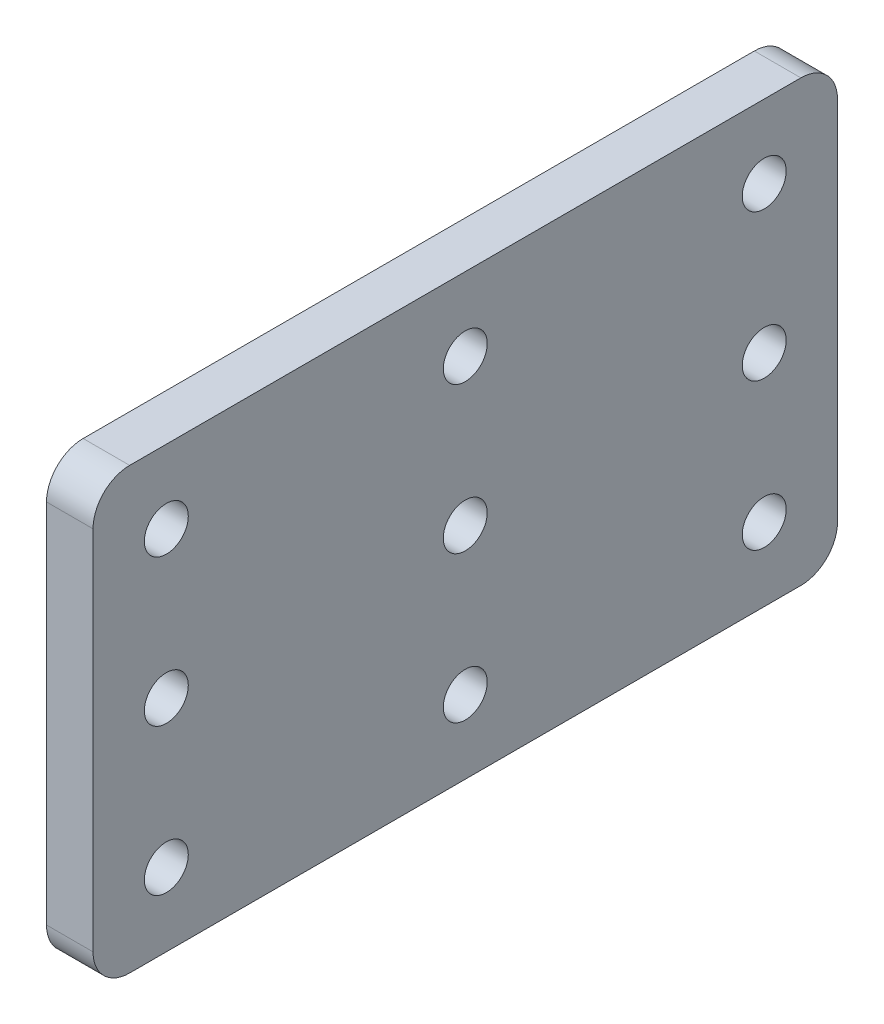
from build123d import *

# Parameters (mm, degrees)
SKETCH1_W           = 6.35
SKETCH1_H           = 60
BOSS_EXTRUDE1_DEPTH = 101.6
SKETCH2_R           = 3
CUT_EXTRUDE1_DEPTH  = 10
FILLET1_R           = 5


with BuildPart() as part:
    # Sketch1 → Boss-Extrude1 (new body)
    with BuildSketch(Plane.XY):
        with Locations((83.183251365, 0)):
            Rectangle(SKETCH1_W, SKETCH1_H)
    extrude(amount=BOSS_EXTRUDE1_DEPTH)

    # Sketch2 → Cut-Extrude1 (cut)
    with BuildSketch(Plane(origin=(86.358251365, 0, 0), x_dir=(0, 0, -1), z_dir=(1, 0, 0))):
        with Locations((-10, -20)):
            Circle(SKETCH2_R)
        with Locations((-10, 20)):
            Circle(SKETCH2_R)
        with Locations((-10, 0)):
            Circle(SKETCH2_R)
        with Locations((-50.8, 20)):
            Circle(SKETCH2_R)
        with Locations((-50.8, 0)):
            Circle(SKETCH2_R)
        with Locations((-50.8, -20)):
            Circle(SKETCH2_R)
        with Locations((-91.6, -20)):
            Circle(SKETCH2_R)
        with Locations((-91.6, 0)):
            Circle(SKETCH2_R)
        with Locations((-91.6, 20)):
            Circle(SKETCH2_R)
    extrude(amount=-CUT_EXTRUDE1_DEPTH, mode=Mode.SUBTRACT)

    # Fillet1
    fillet1_edges = [part.edges().sort_by_distance(p)[0] for p in [
        (83.183251365, 30, 101.6),
        (83.183251365, 30, 0),
        (83.183251365, -30, 0),
        (83.183251365, -30, 101.6),
    ]]
    fillet(fillet1_edges, radius=FILLET1_R)


solid = part.part
